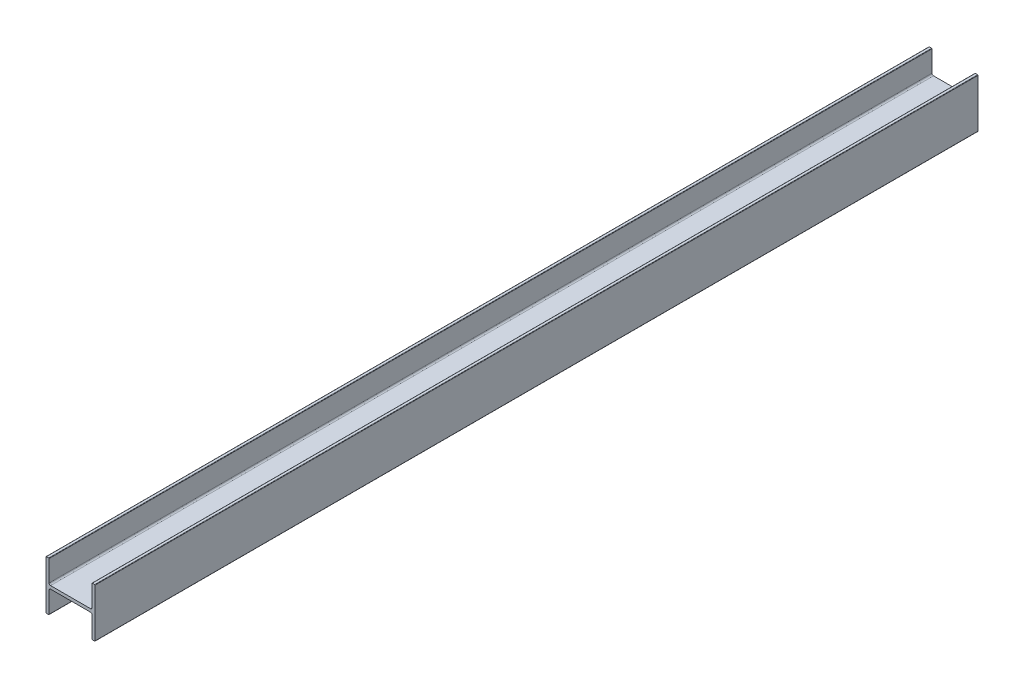
from build123d import *

# Parameters (mm, degrees)
BOSS_EXTRUDE1_DEPTH      = 457.2
BOSS_EXTRUDE1_DEPTH_BACK = 457.2
FILLET1_R                = 1.5875
FILLET2_R                = 0.396875


with BuildPart() as part:
    # Sketch3 → Boss-Extrude1 (new, two sides: drawn at the far end of the back side and taken through both)
    with BuildSketch(Plane.XY.offset(-BOSS_EXTRUDE1_DEPTH_BACK)):
        Polygon((25.4, -25.4), (25.4, 25.4), (22.225, 25.4), (22.225, 1.5875), (-22.225, 1.5875), (-22.225, 25.4), (-25.4, 25.4), (-25.4, -25.4), (-22.225, -25.4), (-22.225, -1.5875), (22.225, -1.5875), (22.225, -25.4), align=None)
    extrude(amount=BOSS_EXTRUDE1_DEPTH + BOSS_EXTRUDE1_DEPTH_BACK)

    # Fillet1
    fillet1_edges = [part.edges().sort_by_distance(p)[0] for p in [
        (22.225, -1.5875, 0),
        (-22.225, -1.5875, 0),
        (-22.225, 1.5875, 0),
        (22.225, 1.5875, 0),
    ]]
    fillet(fillet1_edges, radius=FILLET1_R)

    # Fillet2
    fillet2_edges = [part.edges().sort_by_distance(p)[0] for p in [
        (22.225, -25.4, 0),
        (-22.225, -25.4, 0),
        (-25.4, -25.4, 0),
        (-25.4, 25.4, 0),
        (-22.225, 25.4, 0),
        (22.225, 25.4, 0),
        (25.4, 25.4, 0),
        (25.4, -25.4, 0),
    ]]
    fillet(fillet2_edges, radius=FILLET2_R)


solid = part.part
